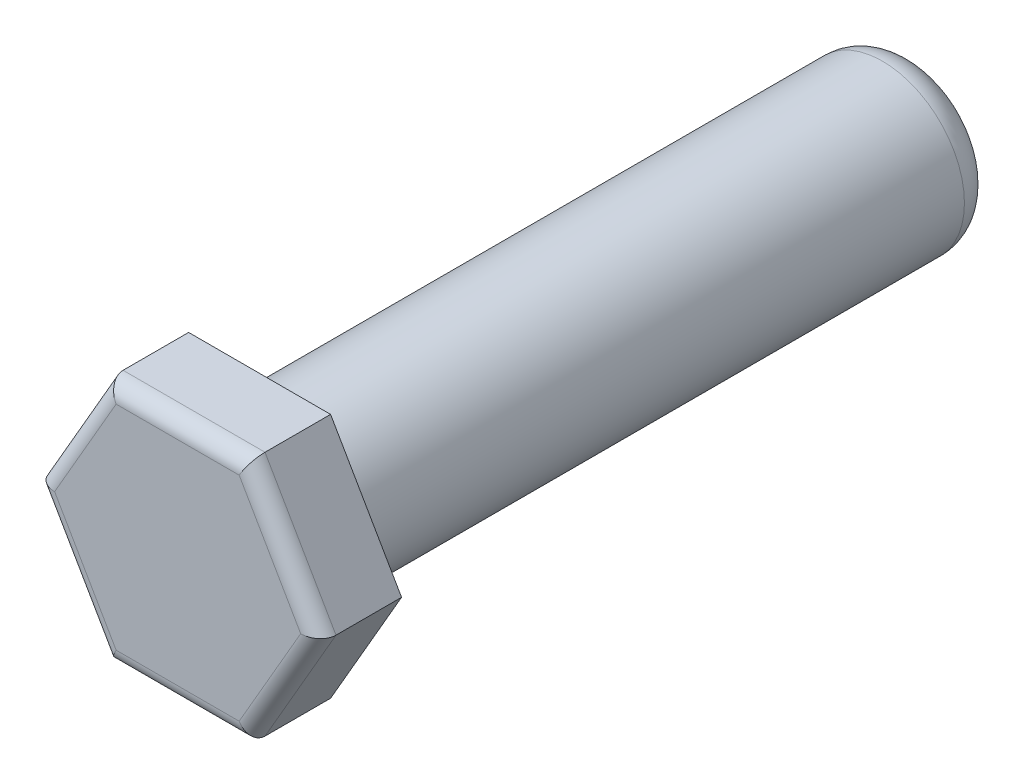
from build123d import *

# Parameters (mm, degrees)
SKETCH_1_R      = 5
EXTRUDE_1_DEPTH = 40
EXTRUDE_2_DEPTH = 5
FILLET_1_R      = 1
FILLET_2_R      = 2


with BuildPart() as part:
    # 草图1 → 凸台-拉伸1 (new body)
    with BuildSketch(Plane.XY):
        Circle(SKETCH_1_R)
    extrude(amount=EXTRUDE_1_DEPTH)

    # 草图2 → 凸台-拉伸2 (add)
    with BuildSketch(Plane.XY.offset(40)):
        Polygon((4.330127019, -7.5), (8.660254038, 0), (4.330127019, 7.5), (-4.330127019, 7.5), (-8.660254038, 0), (-4.330127019, -7.5), align=None)
    extrude(amount=EXTRUDE_2_DEPTH)

    # 圆角1
    fillet_1_edges = [part.edges().sort_by_distance(p)[0] for p in [
        (0, -7.5, 45),
        (6.495190528, -3.75, 45),
        (6.495190528, 3.75, 45),
        (0, 7.5, 45),
        (-6.495190528, 3.75, 45),
        (-6.495190528, -3.75, 45),
    ]]
    fillet(fillet_1_edges, radius=FILLET_1_R)

    # 圆角2
    fillet_2_edges = [part.edges().sort_by_distance(p)[0] for p in [
        (-5, 0, 0),
    ]]
    fillet(fillet_2_edges, radius=FILLET_2_R)


solid = part.part
